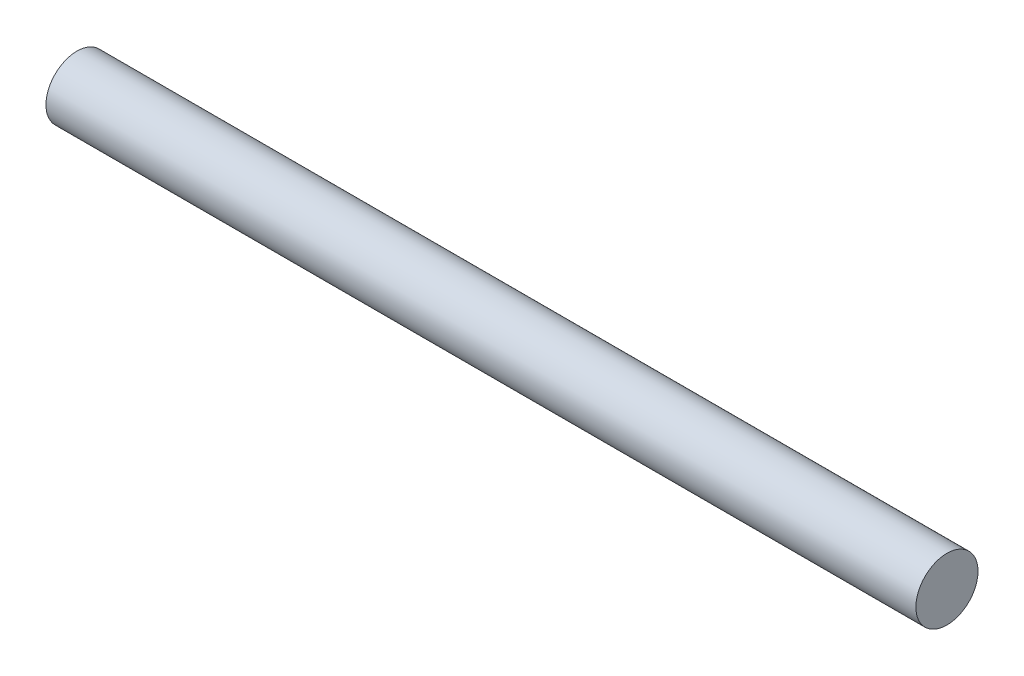
from build123d import *

# Parameters (mm, degrees)
SKETCH1_R           = 7.5
BOSS_EXTRUDE1_DEPTH = 210


with BuildPart() as part:
    # Sketch1 → Boss-Extrude1 (new body)
    with BuildSketch(Plane.YZ):
        with Locations(Location((0, 0, 0), (0, 0, 270))):
            Circle(SKETCH1_R)
    extrude(amount=BOSS_EXTRUDE1_DEPTH)


solid = part.part
